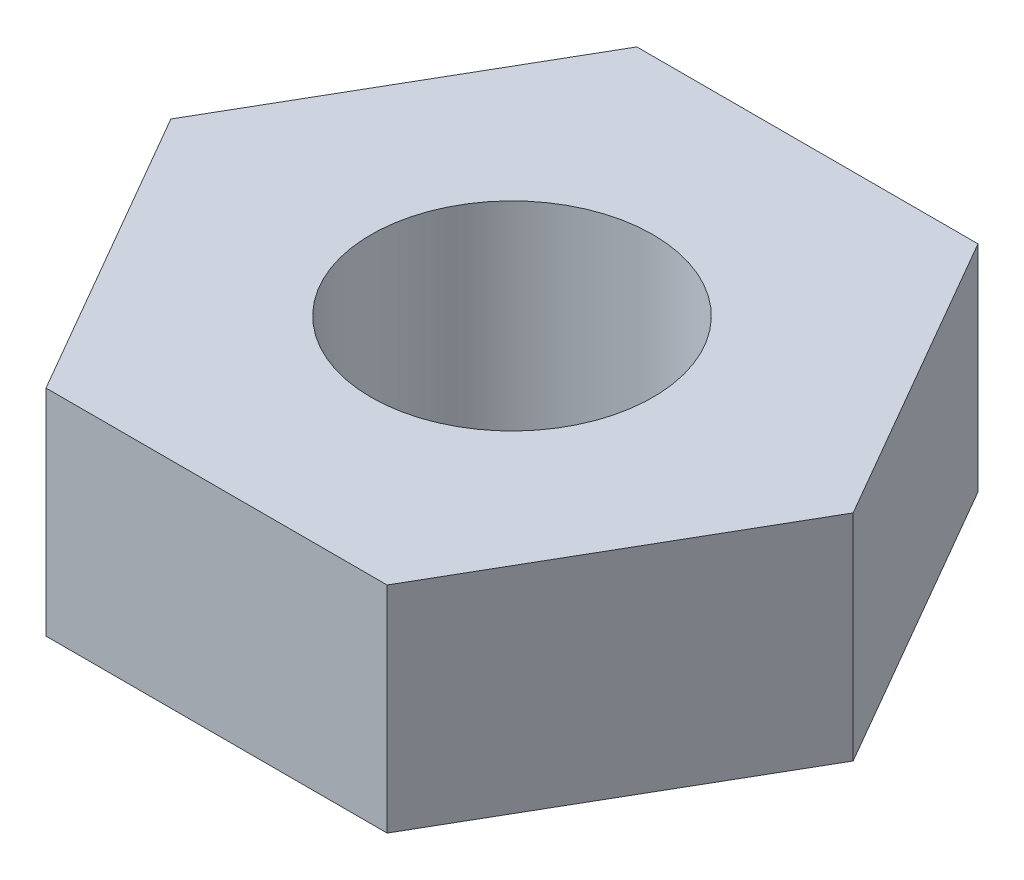
from build123d import *

# Parameters (mm, degrees)
BOSS_EXTRU_1_DEPTH      = 3.175
ESQUISSE2_R             = 2.0828
ENL_V_MAT_EXTRU_1_DEPTH = 8.385856901


with BuildPart() as part:
    # Esquisse1 → Boss.-Extru.1 (new body)
    with BuildSketch(Plane(origin=(0, 0, 0), x_dir=(1, 0, 0), z_dir=(0, 1, 0))):
        Polygon((2.520494769, 4.365625), (-2.520494769, 4.365625), (-5.040989538, 0), (-2.520494769, -4.365625), (2.520494769, -4.365625), (5.040989538, 0), align=None)
    extrude(amount=BOSS_EXTRU_1_DEPTH)

    # Esquisse2 → Enlèv. mat.-Extru.1 (cut, through all)
    with BuildSketch(Plane(origin=(0, 3.175, 0), x_dir=(1, 0, 0), z_dir=(0, 1, 0))):
        with Locations(Location((0, 0, 0), (0, 0, 270))):
            Circle(ESQUISSE2_R)
    extrude(amount=-ENL_V_MAT_EXTRU_1_DEPTH, mode=Mode.SUBTRACT)


solid = part.part
